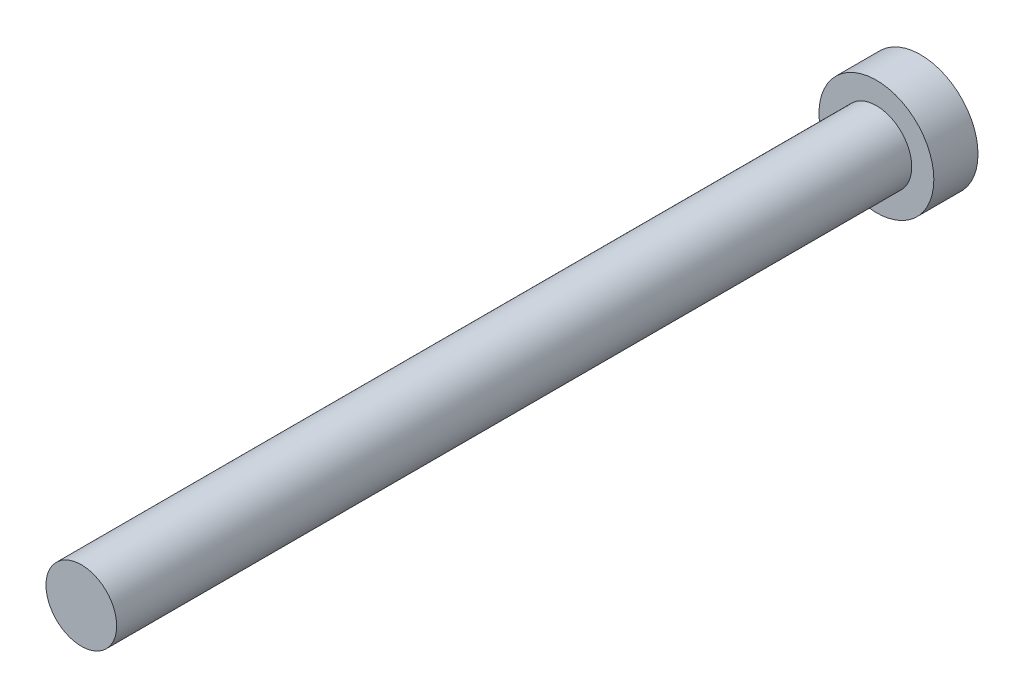
from build123d import *

# Parameters (mm, degrees)
SKETCH_1_R      = 6.5
EXTRUDE_1_DEPTH = 5
SKETCH_2_R      = 4
EXTRUDE_2_DEPTH = 90


with BuildPart() as part:
    # 草图1 → 凸台-拉伸1 (new body)
    with BuildSketch(Plane.XY):
        Circle(SKETCH_1_R)
    extrude(amount=EXTRUDE_1_DEPTH)

    # 草图2 → 凸台-拉伸2 (add)
    with BuildSketch(Plane.XY.offset(5)):
        with Locations(Location((0, 0, 0), (0, 0, 180))):
            Circle(SKETCH_2_R)
    extrude(amount=EXTRUDE_2_DEPTH)


solid = part.part
